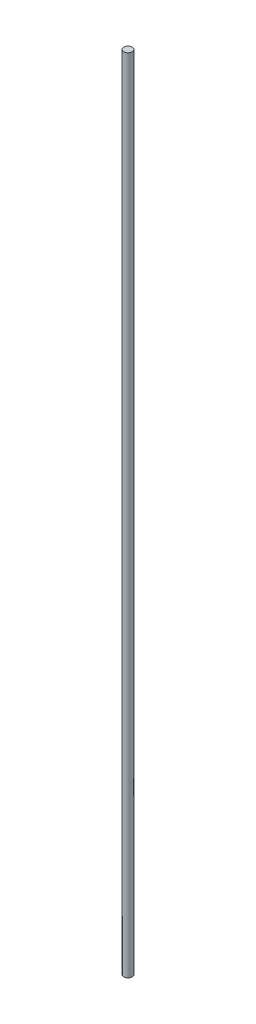
from build123d import *

# Parameters (mm, degrees)
SKETCH1_R           = 0.79375
BOSS_EXTRUDE1_DEPTH = 152.4


with BuildPart() as part:
    # Sketch1 → Boss-Extrude1 (new body)
    with BuildSketch(Plane(origin=(0, 0, 0), x_dir=(1, 0, 0), z_dir=(0, 1, 0))):
        with Locations(Location((0, 0, 0), (0, 0, 90))):
            Circle(SKETCH1_R)
    extrude(amount=BOSS_EXTRUDE1_DEPTH)


solid = part.part
